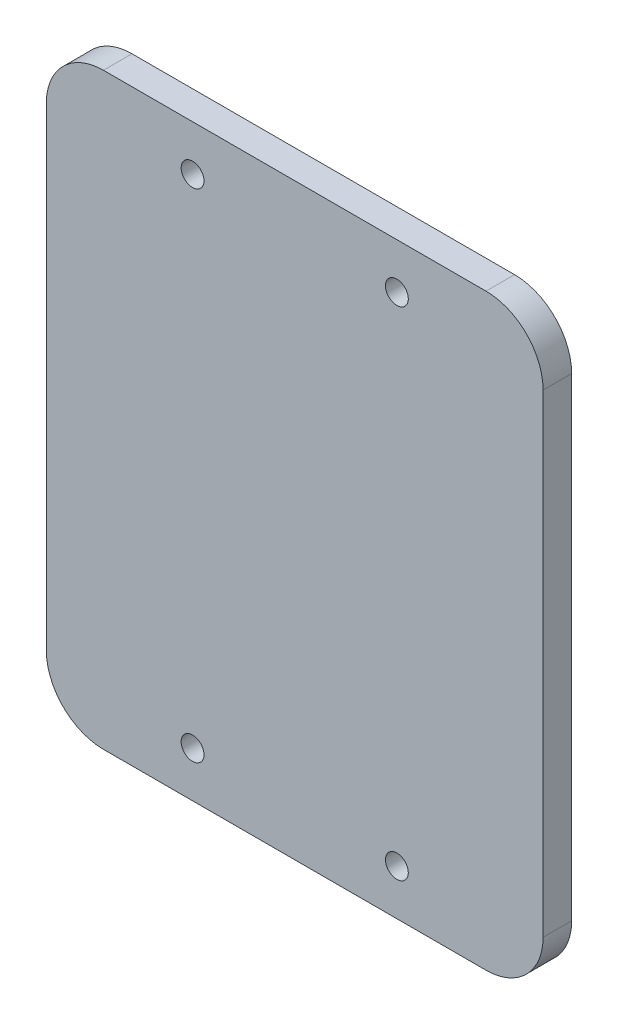
from build123d import *

# Parameters (mm, degrees)
CROQUIS1_W              = 87
CROQUIS1_H              = 103
CROQUIS1_R              = 2
SALIENTE_EXTRUIR1_DEPTH = 5
REDONDEO1_R             = 10


with BuildPart() as part:
    # Croquis1 → Saliente-Extruir1 (new body)
    with BuildSketch(Plane.XY):
        with Locations((13.390838462, -31.317238422)):
            Rectangle(CROQUIS1_W, CROQUIS1_H)
        with Locations((-4.499161538, 12.202761578)):
            Circle(CROQUIS1_R, mode=Mode.SUBTRACT)
        with Locations(Location((31.280838462, 12.202761578, 0), (0, 0, 180))):
            Circle(CROQUIS1_R, mode=Mode.SUBTRACT)
        with Locations((31.280838462, -74.837238422)):
            Circle(CROQUIS1_R, mode=Mode.SUBTRACT)
        with Locations(Location((-4.499161538, -74.837238422, 0), (0, 0, 180))):
            Circle(CROQUIS1_R, mode=Mode.SUBTRACT)
    extrude(amount=SALIENTE_EXTRUIR1_DEPTH)

    # Redondeo1
    redondeo1_edges = [part.edges().sort_by_distance(p)[0] for p in [
        (-30.109161538, 20.182761578, 2.5),
        (56.890838462, 20.182761578, 2.5),
        (56.890838462, -82.817238422, 2.5),
        (-30.109161538, -82.817238422, 2.5),
    ]]
    fillet(redondeo1_edges, radius=REDONDEO1_R)


solid = part.part
